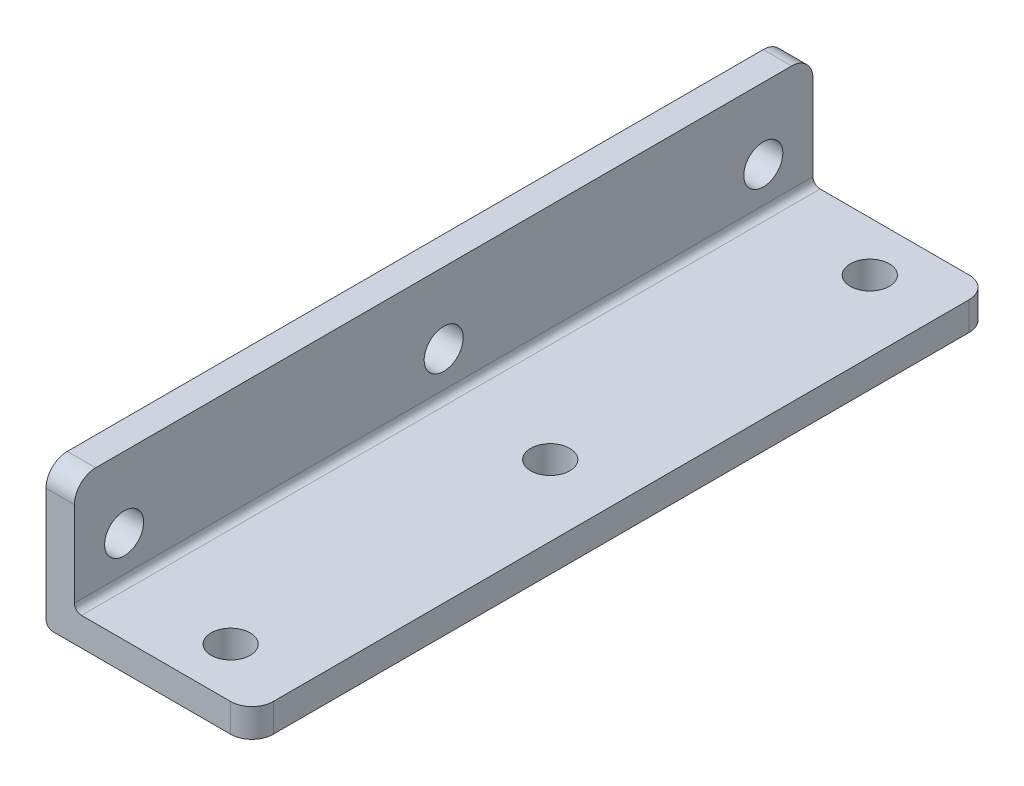
from build123d import *

# Parameters (mm, degrees)
SKETCH_1_W          = 29
SKETCH_1_H          = 4
SKETCH_1_W_2        = 4
SKETCH_1_H_2        = 16
EXTRUDE_1_DEPTH     = 55
SKETCH_3_R          = 2.75
CUT_EXTRUDE_3_DEPTH = 20
SKETCH_2_R          = 2.75
CUT_EXTRUDE_4_DEPTH = 20
FILLET_2_R          = 1
CUT_EXTRUDE_START   = -3
CUT_EXTRUDE_5_DEPTH = 3
CUT_EXTRUDE_6_DEPTH = 3
FILLET_3_R          = 3


with BuildPart() as part:
    # 스케치1 → 보스-돌출1 (new, symmetric)
    with BuildSketch(Plane.XY):
        with Locations((14.5, -2)):
            Rectangle(SKETCH_1_W, SKETCH_1_H)
        with Locations((2, 8)):
            Rectangle(SKETCH_1_W_2, SKETCH_1_H_2)
    extrude(amount=EXTRUDE_1_DEPTH, both=True)

    # 스케치3 → 컷-돌출3 (cut)
    with BuildSketch(Plane(origin=(4, 0, 0), x_dir=(0, 0, -1), z_dir=(1, 0, 0))):
        with Locations(Location((0, 6, 0), (0, 0, 90))):
            Circle(SKETCH_3_R)
        with Locations(Location((-45, 6, 0), (0, 0, 90))):
            Circle(SKETCH_3_R)
        with Locations(Location((45, 6, 0), (0, 0, 90))):
            Circle(SKETCH_3_R)
    extrude(amount=-CUT_EXTRUDE_3_DEPTH, mode=Mode.SUBTRACT)

    # 스케치2 → 컷-돌출4 (cut)
    with BuildSketch(Plane(origin=(0, 0, 0), x_dir=(1, 0, 0), z_dir=(0, 1, 0))):
        with Locations(Location((19, 0, 0), (0, 0, 180))):
            Circle(SKETCH_2_R)
        with Locations(Location((19, -45, 0), (0, 0, 180))):
            Circle(SKETCH_2_R)
        with Locations(Location((19, 45, 0), (0, 0, 180))):
            Circle(SKETCH_2_R)
    extrude(amount=-CUT_EXTRUDE_4_DEPTH, mode=Mode.SUBTRACT)

    # 필렛2
    fillet_2_edges = [part.edges().sort_by_distance(p)[0] for p in [
        (0, -4, 0),
        (4, 0, 0),
    ]]
    fillet(fillet_2_edges, radius=FILLET_2_R)

    # 스케치4 → 컷-돌출5 (cut)
    with BuildSketch(Plane.XY.offset(55).offset(CUT_EXTRUDE_START)):
        with BuildLine():
            Line((0, 16), (0, -3))
            ThreePointArc((0, -3), (0.292893219, -3.707106781), (1, -4))
            Line((1, -4), (29, -4))
            Line((29, -4), (29, 0))
            Line((29, 0), (5, 0))
            ThreePointArc((5, 0), (4.292893219, 0.292893219), (4, 1))
            Line((4, 1), (4, 16))
            Line((4, 16), (0, 16))
        make_face()
    extrude(amount=CUT_EXTRUDE_5_DEPTH, mode=Mode.SUBTRACT)

    # 스케치5 → 컷-돌출6 (cut)
    with BuildSketch(Plane(origin=(0, 0, -55), x_dir=(-1, 0, 0), z_dir=(0, 0, -1))):
        with BuildLine():
            Line((-29, -4), (-1, -4))
            ThreePointArc((-1, -4), (-0.292893219, -3.707106781), (0, -3))
            Line((0, -3), (0, 16))
            Line((0, 16), (-4, 16))
            Line((-4, 16), (-4, 1))
            ThreePointArc((-4, 1), (-4.292893219, 0.292893219), (-5, 0))
            Line((-5, 0), (-29, 0))
            Line((-29, 0), (-29, -4))
        make_face()
    extrude(amount=-CUT_EXTRUDE_6_DEPTH, mode=Mode.SUBTRACT)

    # 필렛3
    fillet_3_edges = [part.edges().sort_by_distance(p)[0] for p in [
        (29, -2, -52),
        (2, 16, -52),
        (2, 16, 52),
        (29, -2, 52),
    ]]
    fillet(fillet_3_edges, radius=FILLET_3_R)


solid = part.part
